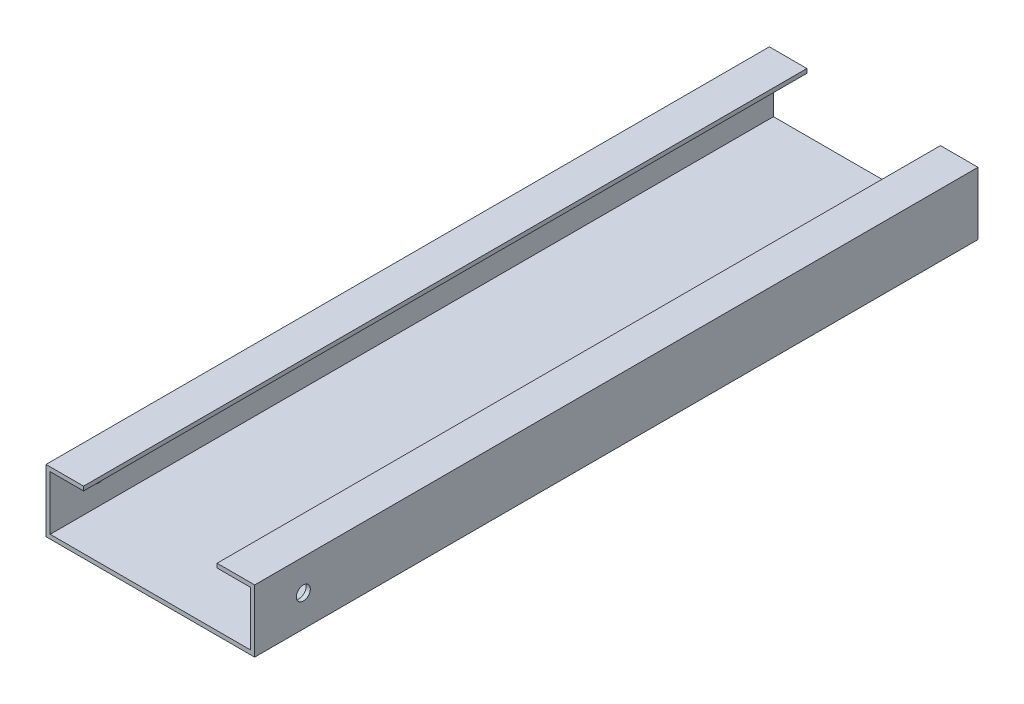
from build123d import *

# Parameters (mm, degrees)
SKETCH1_W               = 150
SKETCH1_H               = 45
BOSS_EXTRUDE1_DEPTH     = 260
CUT_EXTRUDE1_DEPTH      = 272.534988537
CUT_EXTRUDE1_DEPTH_BACK = 272.534988537
SKETCH2_W               = 144
SKETCH2_H               = 39
SKETCH3_W               = 96
SKETCH3_H               = 11.757854584
CUT_EXTRUDE2_DEPTH      = 526.862386942
SKETCH4_R               = 5
CUT_EXTRUDE3_DEPTH      = 302.008720804


with BuildPart() as part:
    # Sketch1 → Boss-Extrude1 (new, symmetric)
    with BuildSketch(Plane.XY):
        Rectangle(SKETCH1_W, SKETCH1_H)
    extrude(amount=BOSS_EXTRUDE1_DEPTH, both=True)

    # Sketch2 → Cut-Extrude1 (cut, two sides: drawn at the far end of the back side and taken through both)
    with BuildSketch(Plane.XY.offset(-CUT_EXTRUDE1_DEPTH_BACK)):
        Rectangle(SKETCH2_W, SKETCH2_H)
    extrude(amount=CUT_EXTRUDE1_DEPTH + CUT_EXTRUDE1_DEPTH_BACK, mode=Mode.SUBTRACT)

    # Sketch3 → Cut-Extrude2 (cut, through all)
    with BuildSketch(Plane.XY.offset(260)):
        with Locations((0, 22.5)):
            Rectangle(SKETCH3_W, SKETCH3_H)
    extrude(amount=-CUT_EXTRUDE2_DEPTH, mode=Mode.SUBTRACT)

    # Sketch4 → Cut-Extrude3 (cut, through all)
    with BuildSketch(Plane.ZY.offset(75)):
        with Locations((225, 0)):
            Circle(SKETCH4_R)
    extrude(amount=-CUT_EXTRUDE3_DEPTH, mode=Mode.SUBTRACT)


solid = part.part
